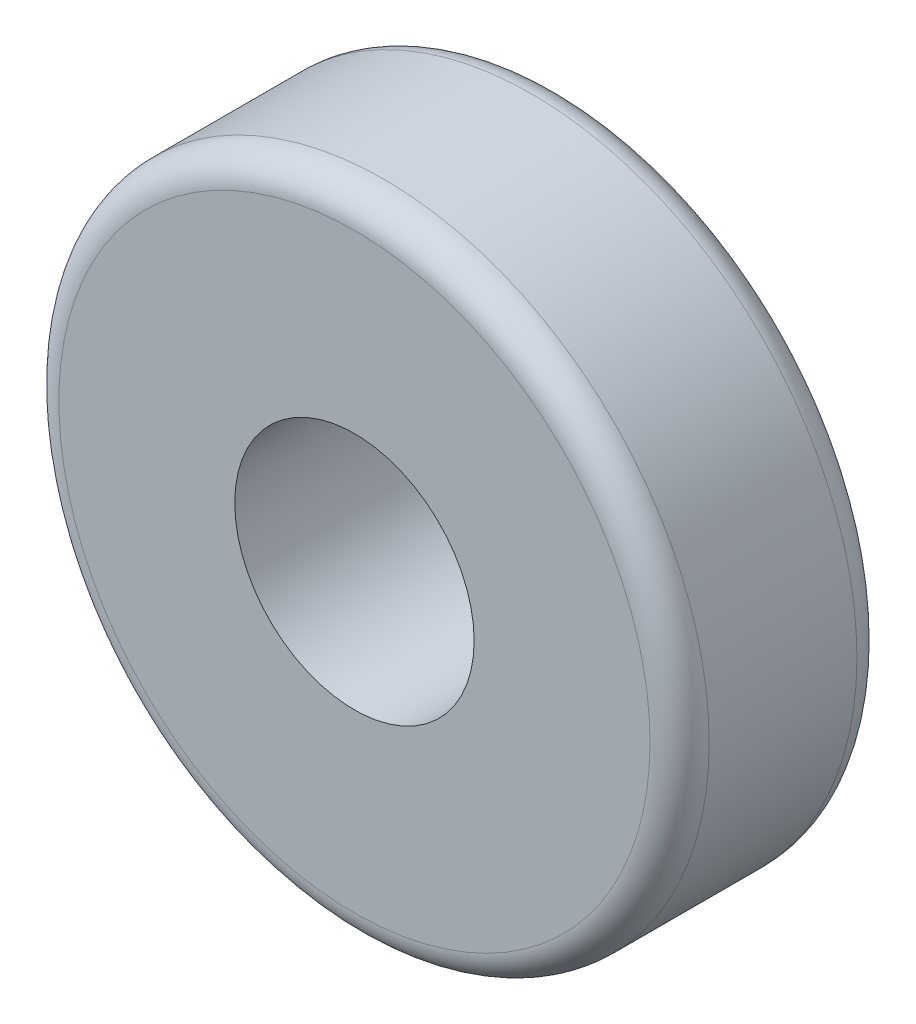
from build123d import *

# Parameters (mm, degrees)
CROQUIS1_R              = 11
CROQUIS1_R_2            = 4.05
SALIENTE_EXTRUIR1_DEPTH = 7
REDONDEO1_R             = 1


with BuildPart() as part:
    # Croquis1 → Saliente-Extruir1 (new body)
    with BuildSketch(Plane.XY):
        Circle(CROQUIS1_R)
        Circle(CROQUIS1_R_2, mode=Mode.SUBTRACT)
    extrude(amount=SALIENTE_EXTRUIR1_DEPTH)

    # Redondeo1
    redondeo1_edges = [part.edges().sort_by_distance(p)[0] for p in [
        (-11, 0, 0),
        (-11, 0, 7),
    ]]
    fillet(redondeo1_edges, radius=REDONDEO1_R)


solid = part.part
